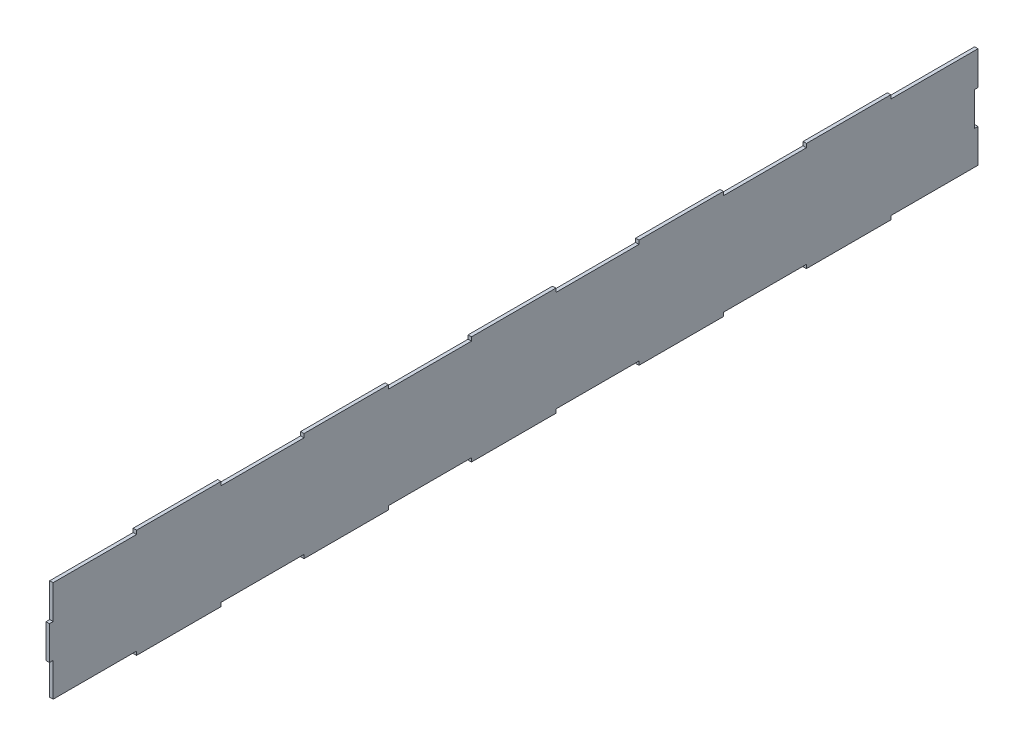
from build123d import *

# Parameters (mm, degrees)
UP_DEPTH = 1.6


with BuildPart() as part:
    # Sketch1 → Up (new body)
    with BuildSketch(Plane(origin=(0, 0, 0), x_dir=(0, 0, -1), z_dir=(1, 0, 0))):
        Polygon((-216.6666645, 23.75), (-177.4327255, 23.75), (-177.4327255, 25.51), (-137.7187865, 25.51), (-137.7187865, 23.75), (-98.6448475, 23.75), (-98.6448475, 25.51), (-58.9309085, 25.51), (-58.9309085, 23.75), (-19.8569695, 23.75), (-19.8569695, 25.51), (19.8569695, 25.51), (19.8569695, 23.75), (58.9309085, 23.75), (58.9309085, 25.51), (98.6448475, 25.51), (98.6448475, 23.75), (137.7187865, 23.75), (137.7187865, 25.51), (177.4327255, 25.51), (177.4327255, 23.75), (216.6666645, 23.75), (218.4266645, 23.75), (218.4266645, 7.916666667), (216.6666645, 7.916666667), (216.6666645, 0), (-216.6666645, 0), (-218.4266645, 0), (-218.4266645, 7.916666667), (-216.6666645, 7.916666667), align=None)
    up = extrude(amount=UP_DEPTH)

    # Mirror2: Up across plane
    add(up.mirror(Plane(origin=(1.6, 0, 216.6666645), x_dir=(0, 0, 1), z_dir=(0, 1, 0))))


solid = part.part
